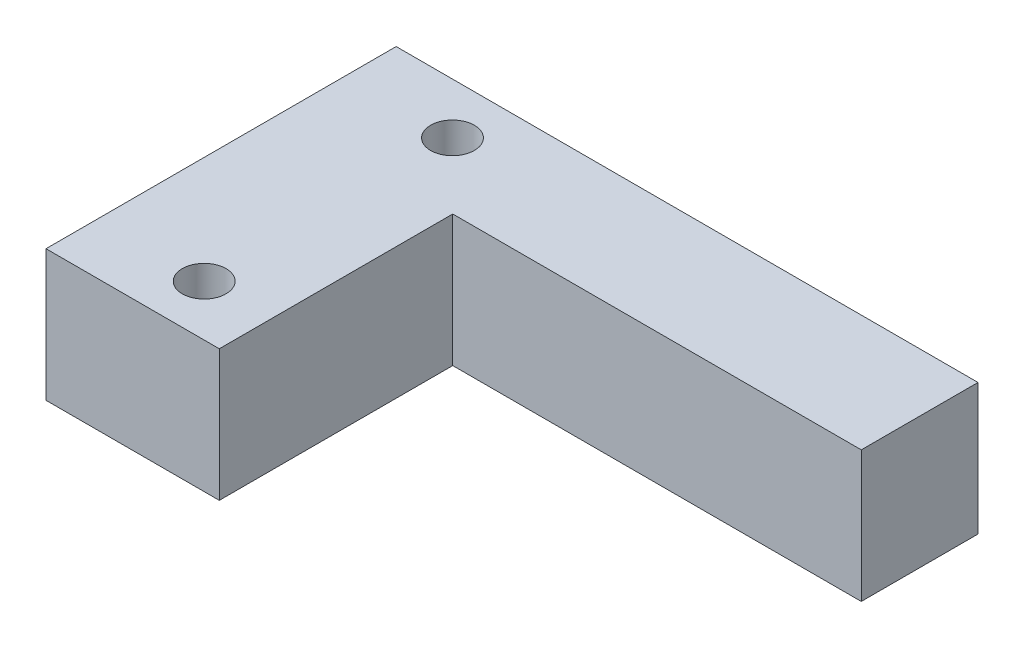
from build123d import *

# Parameters (mm, degrees)
SKETCH1_W           = 39.878
SKETCH1_H           = 24
BOSS_EXTRUDE1_DEPTH = 9
SKETCH2_W           = 28
SKETCH2_H           = 16
CUT_EXTRUDE1_DEPTH  = 25.951226844
SKETCH4_R           = 1.5
CUT_EXTRUDE2_DEPTH  = 25.951226844


with BuildPart() as part:
    # Sketch1 → Boss-Extrude1 (new body)
    with BuildSketch(Plane(origin=(0, 0, 0), x_dir=(1, 0, 0), z_dir=(0, 1, 0))):
        Rectangle(SKETCH1_W, SKETCH1_H)
    extrude(amount=BOSS_EXTRUDE1_DEPTH)

    # Sketch2 → Cut-Extrude1 (cut, through all)
    with BuildSketch(Plane(origin=(0, 9, 0), x_dir=(1, 0, 0), z_dir=(0, 1, 0))):
        with Locations((5.939, -4)):
            Rectangle(SKETCH2_W, SKETCH2_H)
    extrude(amount=-CUT_EXTRUDE1_DEPTH, mode=Mode.SUBTRACT)

    # Sketch4 → Cut-Extrude2 (cut, through all)
    with BuildSketch(Plane(origin=(0, 9, 0), x_dir=(1, 0, 0), z_dir=(0, 1, 0))):
        with Locations(Location((-12.589, -8.509, 0), (0, 0, 270))):
            Circle(SKETCH4_R)
        with Locations(Location((-12.589, 8.509, 0), (0, 0, 270))):
            Circle(SKETCH4_R)
    extrude(amount=-CUT_EXTRUDE2_DEPTH, mode=Mode.SUBTRACT)


solid = part.part
